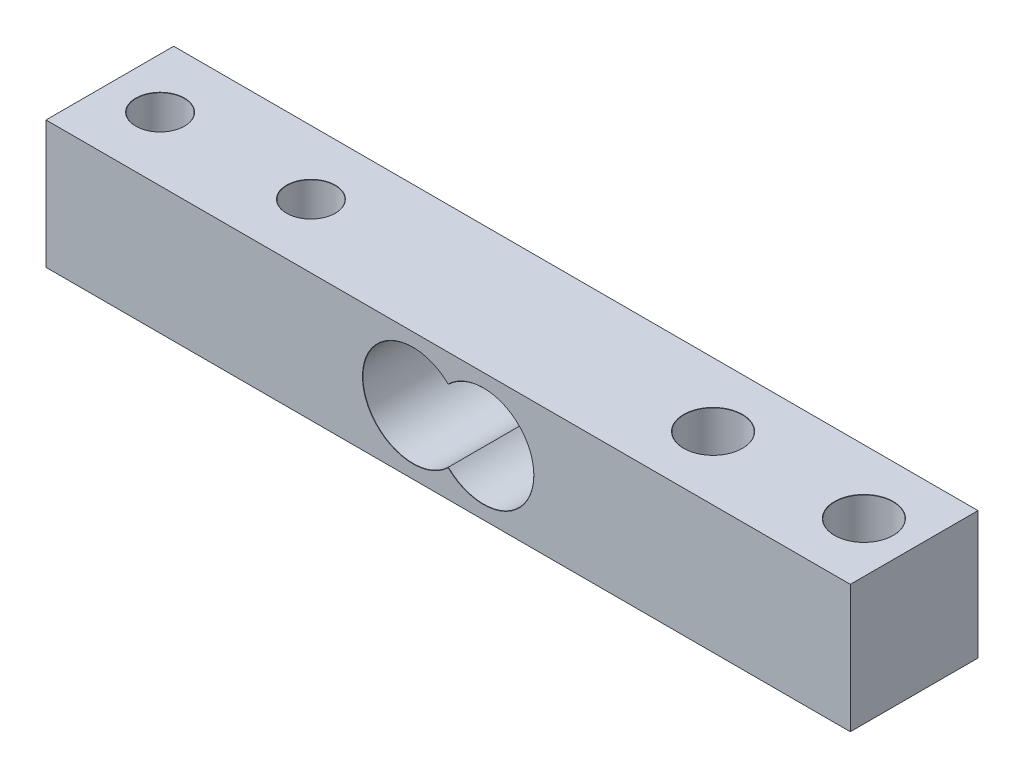
from build123d import *

# Parameters (mm, degrees)
SKETCH1_W                      = 80
SKETCH1_H                      = 12.7
BOSS_EXTRUDE1_DEPTH            = 12.7
M4_CLEARANCE_HOLE1_D           = 4.8
M4_CLEARANCE_HOLE1_CSINK_D     = 4.85
M4_CLEARANCE_HOLE1_CSINK_ANGLE = 100
M8_CLEARANCE_HOLE1_D           = 10
M8_CLEARANCE_HOLE1_CSINK_D     = 10.05
M8_CLEARANCE_HOLE1_CSINK_ANGLE = 100
M5_CLEARANCE_HOLE1_D           = 5.8
M5_CLEARANCE_HOLE1_CSINK_D     = 5.85
M5_CLEARANCE_HOLE1_CSINK_ANGLE = 100


with BuildPart() as part:
    # Sketch1 → Boss-Extrude1 (new body)
    with BuildSketch(Plane(origin=(0, 0, 0), x_dir=(1, 0, 0), z_dir=(0, 1, 0))):
        Rectangle(SKETCH1_W, SKETCH1_H)
    extrude(amount=BOSS_EXTRUDE1_DEPTH)

    # M4 Clearance Hole1 (through all)
    with Locations(Plane(origin=(0, 12.7, 0), x_dir=(1, 0, 0), z_dir=(0, 1, 0))):
        with Locations((-35, 0), (-20, 0)):
            CounterSinkHole(M4_CLEARANCE_HOLE1_D / 2, M4_CLEARANCE_HOLE1_CSINK_D / 2, counter_sink_angle=M4_CLEARANCE_HOLE1_CSINK_ANGLE)

    # M8 Clearance Hole1 (through all)
    with Locations(Plane.XY.offset(6.35)):
        with Locations((-3.5, 6.35), (3.5, 6.35)):
            CounterSinkHole(M8_CLEARANCE_HOLE1_D / 2, M8_CLEARANCE_HOLE1_CSINK_D / 2, counter_sink_angle=M8_CLEARANCE_HOLE1_CSINK_ANGLE)

    # M5 Clearance Hole1 (through all)
    with Locations(Plane(origin=(0, 12.7, 0), x_dir=(1, 0, 0), z_dir=(0, 1, 0))):
        with Locations((35, 0), (20, 0)):
            CounterSinkHole(M5_CLEARANCE_HOLE1_D / 2, M5_CLEARANCE_HOLE1_CSINK_D / 2, counter_sink_angle=M5_CLEARANCE_HOLE1_CSINK_ANGLE)


solid = part.part
